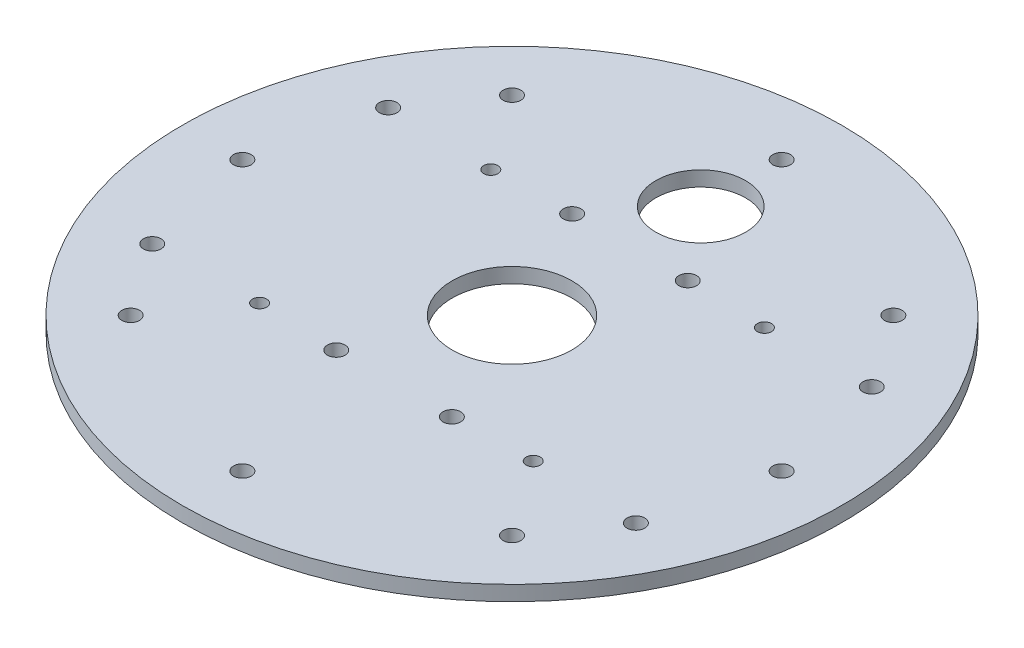
from build123d import *

# Parameters (mm, degrees)
SKETCH1_R                 = 69.85
PLATE_DEPTH               = 3.175
PLATE_CENTER_HOLE_REACH   = 100.834
SKETCH2_R                 = 12.7
PLATE_THROUGH_HOLES_REACH = 100.834
SKETCH13_R                = 1.875
SKETCH13_R_2              = 1.5
SKETCH13_R_3              = 9.5


with BuildPart() as part:
    # Sketch1 → plate (new body)
    with BuildSketch(Plane(origin=(0, 0, 0), x_dir=(1, 0, 0), z_dir=(0, 1, 0))):
        with Locations(Location((0, 0, 0), (0, 0, 270))):
            Circle(SKETCH1_R)
    extrude(amount=PLATE_DEPTH)

    # Sketch2 → plate center hole (cut, up to next)
    with BuildSketch(Plane.XZ, mode=Mode.PRIVATE) as plate_center_hole_sk1:
        with Locations(Location((0, 0, 0), (0, 0, 270))):
            Circle(SKETCH2_R)
    plate_center_hole_tool1 = extrude(plate_center_hole_sk1.sketch, amount=-PLATE_CENTER_HOLE_REACH, mode=Mode.PRIVATE) & part.part
    add(plate_center_hole_tool1.solids().sort_by_distance((0, 0, 0))[0], mode=Mode.SUBTRACT)

    # Sketch13 → plate through holes (cut, up to next)
    with BuildSketch(Plane.XZ, mode=Mode.PRIVATE) as plate_through_holes_sk1:
        with Locations(Location((-12.25, 25, 0), (0, 0, 270))):
            Circle(SKETCH13_R)
    plate_through_holes_tool1 = extrude(plate_through_holes_sk1.sketch, amount=-PLATE_THROUGH_HOLES_REACH, mode=Mode.PRIVATE) & part.part
    # Sketch13 → plate through holes (cut, up to next)
    with BuildSketch(Plane.XZ, mode=Mode.PRIVATE) as plate_through_holes_sk2:
        with Locations(Location((-51.25, 25, 0), (0, 0, 90))):
            Circle(SKETCH13_R)
    plate_through_holes_tool2 = extrude(plate_through_holes_sk2.sketch, amount=-PLATE_THROUGH_HOLES_REACH, mode=Mode.PRIVATE) & part.part
    # Sketch13 → plate through holes (cut, up to next)
    with BuildSketch(Plane.XZ, mode=Mode.PRIVATE) as plate_through_holes_sk3:
        with Locations(Location((-51.25, -25, 0), (0, 0, 270))):
            Circle(SKETCH13_R)
    plate_through_holes_tool3 = extrude(plate_through_holes_sk3.sketch, amount=-PLATE_THROUGH_HOLES_REACH, mode=Mode.PRIVATE) & part.part
    # Sketch13 → plate through holes (cut, up to next)
    with BuildSketch(Plane.XZ, mode=Mode.PRIVATE) as plate_through_holes_sk4:
        with Locations(Location((-12.25, -25, 0), (0, 0, 90))):
            Circle(SKETCH13_R)
    plate_through_holes_tool4 = extrude(plate_through_holes_sk4.sketch, amount=-PLATE_THROUGH_HOLES_REACH, mode=Mode.PRIVATE) & part.part
    # Sketch13 → plate through holes (cut, up to next)
    with BuildSketch(Plane.XZ, mode=Mode.PRIVATE) as plate_through_holes_sk5:
        with Locations(Location((12.25, -25, 0), (0, 0, 270))):
            Circle(SKETCH13_R)
    plate_through_holes_tool5 = extrude(plate_through_holes_sk5.sketch, amount=-PLATE_THROUGH_HOLES_REACH, mode=Mode.PRIVATE) & part.part
    # Sketch13 → plate through holes (cut, up to next)
    with BuildSketch(Plane.XZ, mode=Mode.PRIVATE) as plate_through_holes_sk6:
        with Locations(Location((51.25, -25, 0), (0, 0, 90))):
            Circle(SKETCH13_R)
    plate_through_holes_tool6 = extrude(plate_through_holes_sk6.sketch, amount=-PLATE_THROUGH_HOLES_REACH, mode=Mode.PRIVATE) & part.part
    # Sketch13 → plate through holes (cut, up to next)
    with BuildSketch(Plane.XZ, mode=Mode.PRIVATE) as plate_through_holes_sk7:
        with Locations(Location((51.25, 25, 0), (0, 0, 270))):
            Circle(SKETCH13_R)
    plate_through_holes_tool7 = extrude(plate_through_holes_sk7.sketch, amount=-PLATE_THROUGH_HOLES_REACH, mode=Mode.PRIVATE) & part.part
    # Sketch13 → plate through holes (cut, up to next)
    with BuildSketch(Plane.XZ, mode=Mode.PRIVATE) as plate_through_holes_sk8:
        with Locations(Location((12.25, 25, 0), (0, 0, 90))):
            Circle(SKETCH13_R)
    plate_through_holes_tool8 = extrude(plate_through_holes_sk8.sketch, amount=-PLATE_THROUGH_HOLES_REACH, mode=Mode.PRIVATE) & part.part
    # Sketch13 → plate through holes (cut, up to next)
    with BuildSketch(Plane.XZ, mode=Mode.PRIVATE) as plate_through_holes_sk9:
        with Locations(Location((57.15, 0, 0), (0, 0, 270))):
            Circle(SKETCH13_R)
    plate_through_holes_tool9 = extrude(plate_through_holes_sk9.sketch, amount=-PLATE_THROUGH_HOLES_REACH, mode=Mode.PRIVATE) & part.part
    # Sketch13 → plate through holes (cut, up to next)
    with BuildSketch(Plane.XZ, mode=Mode.PRIVATE) as plate_through_holes_sk10:
        with Locations(Location((40.411152545, 40.411152545, 0), (0, 0, 270))):
            Circle(SKETCH13_R)
    plate_through_holes_tool10 = extrude(plate_through_holes_sk10.sketch, amount=-PLATE_THROUGH_HOLES_REACH, mode=Mode.PRIVATE) & part.part
    # Sketch13 → plate through holes (cut, up to next)
    with BuildSketch(Plane.XZ, mode=Mode.PRIVATE) as plate_through_holes_sk11:
        with Locations(Location((40.411152545, -40.411152545, 0), (0, 0, 270))):
            Circle(SKETCH13_R)
    plate_through_holes_tool11 = extrude(plate_through_holes_sk11.sketch, amount=-PLATE_THROUGH_HOLES_REACH, mode=Mode.PRIVATE) & part.part
    # Sketch13 → plate through holes (cut, up to next)
    with BuildSketch(Plane.XZ, mode=Mode.PRIVATE) as plate_through_holes_sk12:
        with Locations(Location((0, -57.15, 0), (0, 0, 270))):
            Circle(SKETCH13_R)
    plate_through_holes_tool12 = extrude(plate_through_holes_sk12.sketch, amount=-PLATE_THROUGH_HOLES_REACH, mode=Mode.PRIVATE) & part.part
    # Sketch13 → plate through holes (cut, up to next)
    with BuildSketch(Plane.XZ, mode=Mode.PRIVATE) as plate_through_holes_sk13:
        with Locations(Location((-40.411152545, -40.411152545, 0), (0, 0, 270))):
            Circle(SKETCH13_R)
    plate_through_holes_tool13 = extrude(plate_through_holes_sk13.sketch, amount=-PLATE_THROUGH_HOLES_REACH, mode=Mode.PRIVATE) & part.part
    # Sketch13 → plate through holes (cut, up to next)
    with BuildSketch(Plane.XZ, mode=Mode.PRIVATE) as plate_through_holes_sk14:
        with Locations(Location((-57.15, 0, 0), (0, 0, 270))):
            Circle(SKETCH13_R)
    plate_through_holes_tool14 = extrude(plate_through_holes_sk14.sketch, amount=-PLATE_THROUGH_HOLES_REACH, mode=Mode.PRIVATE) & part.part
    # Sketch13 → plate through holes (cut, up to next)
    with BuildSketch(Plane.XZ, mode=Mode.PRIVATE) as plate_through_holes_sk15:
        with Locations(Location((-40.411152545, 40.411152545, 0), (0, 0, 270))):
            Circle(SKETCH13_R)
    plate_through_holes_tool15 = extrude(plate_through_holes_sk15.sketch, amount=-PLATE_THROUGH_HOLES_REACH, mode=Mode.PRIVATE) & part.part
    # Sketch13 → plate through holes (cut, up to next)
    with BuildSketch(Plane.XZ, mode=Mode.PRIVATE) as plate_through_holes_sk16:
        with Locations(Location((0, 57.15, 0), (0, 0, 270))):
            Circle(SKETCH13_R)
    plate_through_holes_tool16 = extrude(plate_through_holes_sk16.sketch, amount=-PLATE_THROUGH_HOLES_REACH, mode=Mode.PRIVATE) & part.part
    # Sketch13 → plate through holes (cut, up to next)
    with BuildSketch(Plane.XZ, mode=Mode.PRIVATE) as plate_through_holes_sk17:
        with Locations(Location((-29, -24.5, 0), (0, 0, 270))):
            Circle(SKETCH13_R_2)
    plate_through_holes_tool17 = extrude(plate_through_holes_sk17.sketch, amount=-PLATE_THROUGH_HOLES_REACH, mode=Mode.PRIVATE) & part.part
    # Sketch13 → plate through holes (cut, up to next)
    with BuildSketch(Plane.XZ, mode=Mode.PRIVATE) as plate_through_holes_sk18:
        with Locations(Location((-29, 24.5, 0), (0, 0, 90))):
            Circle(SKETCH13_R_2)
    plate_through_holes_tool18 = extrude(plate_through_holes_sk18.sketch, amount=-PLATE_THROUGH_HOLES_REACH, mode=Mode.PRIVATE) & part.part
    # Sketch13 → plate through holes (cut, up to next)
    with BuildSketch(Plane.XZ, mode=Mode.PRIVATE) as plate_through_holes_sk19:
        with Locations(Location((29, 24.5, 0), (0, 0, 270))):
            Circle(SKETCH13_R_2)
    plate_through_holes_tool19 = extrude(plate_through_holes_sk19.sketch, amount=-PLATE_THROUGH_HOLES_REACH, mode=Mode.PRIVATE) & part.part
    # Sketch13 → plate through holes (cut, up to next)
    with BuildSketch(Plane.XZ, mode=Mode.PRIVATE) as plate_through_holes_sk20:
        with Locations(Location((29, -24.5, 0), (0, 0, 90))):
            Circle(SKETCH13_R_2)
    plate_through_holes_tool20 = extrude(plate_through_holes_sk20.sketch, amount=-PLATE_THROUGH_HOLES_REACH, mode=Mode.PRIVATE) & part.part
    # Sketch13 → plate through holes (cut, up to next)
    with BuildSketch(Plane.XZ, mode=Mode.PRIVATE) as plate_through_holes_sk21:
        with Locations(Location((0, -40, 0), (0, 0, 270))):
            Circle(SKETCH13_R_3)
    plate_through_holes_tool21 = extrude(plate_through_holes_sk21.sketch, amount=-PLATE_THROUGH_HOLES_REACH, mode=Mode.PRIVATE) & part.part
    add(plate_through_holes_tool1.solids().sort_by_distance((-12.25, 0, 25))[0], mode=Mode.SUBTRACT)
    add(plate_through_holes_tool2.solids().sort_by_distance((-51.25, 0, 25))[0], mode=Mode.SUBTRACT)
    add(plate_through_holes_tool3.solids().sort_by_distance((-51.25, 0, -25))[0], mode=Mode.SUBTRACT)
    add(plate_through_holes_tool4.solids().sort_by_distance((-12.25, 0, -25))[0], mode=Mode.SUBTRACT)
    add(plate_through_holes_tool5.solids().sort_by_distance((12.25, 0, -25))[0], mode=Mode.SUBTRACT)
    add(plate_through_holes_tool6.solids().sort_by_distance((51.25, 0, -25))[0], mode=Mode.SUBTRACT)
    add(plate_through_holes_tool7.solids().sort_by_distance((51.25, 0, 25))[0], mode=Mode.SUBTRACT)
    add(plate_through_holes_tool8.solids().sort_by_distance((12.25, 0, 25))[0], mode=Mode.SUBTRACT)
    add(plate_through_holes_tool9.solids().sort_by_distance((57.15, 0, 0))[0], mode=Mode.SUBTRACT)
    add(plate_through_holes_tool10.solids().sort_by_distance((40.411153, 0, 40.411153))[0], mode=Mode.SUBTRACT)
    add(plate_through_holes_tool11.solids().sort_by_distance((40.411153, 0, -40.411153))[0], mode=Mode.SUBTRACT)
    add(plate_through_holes_tool12.solids().sort_by_distance((0, 0, -57.15))[0], mode=Mode.SUBTRACT)
    add(plate_through_holes_tool13.solids().sort_by_distance((-40.411153, 0, -40.411153))[0], mode=Mode.SUBTRACT)
    add(plate_through_holes_tool14.solids().sort_by_distance((-57.15, 0, 0))[0], mode=Mode.SUBTRACT)
    add(plate_through_holes_tool15.solids().sort_by_distance((-40.411153, 0, 40.411153))[0], mode=Mode.SUBTRACT)
    add(plate_through_holes_tool16.solids().sort_by_distance((0, 0, 57.15))[0], mode=Mode.SUBTRACT)
    add(plate_through_holes_tool17.solids().sort_by_distance((-29, 0, -24.5))[0], mode=Mode.SUBTRACT)
    add(plate_through_holes_tool18.solids().sort_by_distance((-29, 0, 24.5))[0], mode=Mode.SUBTRACT)
    add(plate_through_holes_tool19.solids().sort_by_distance((29, 0, 24.5))[0], mode=Mode.SUBTRACT)
    add(plate_through_holes_tool20.solids().sort_by_distance((29, 0, -24.5))[0], mode=Mode.SUBTRACT)
    add(plate_through_holes_tool21.solids().sort_by_distance((0, 0, -40))[0], mode=Mode.SUBTRACT)


solid = part.part
